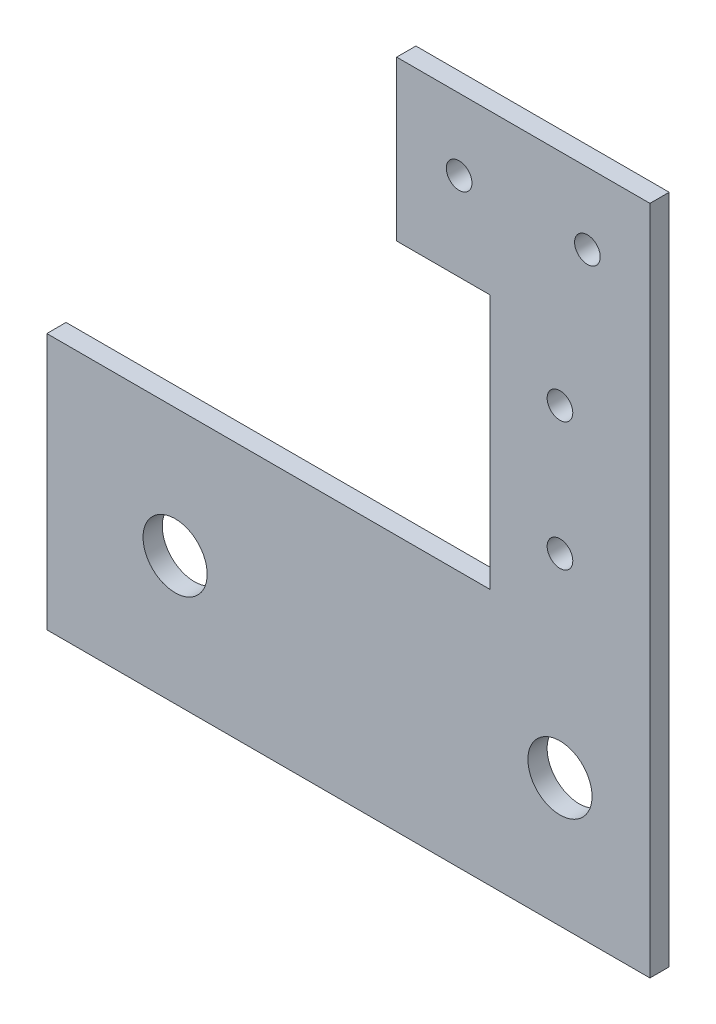
from build123d import *

# Parameters (mm, degrees)
SKETCH1_R           = 2.5
SKETCH1_R_2         = 1
BOSS_EXTRUDE1_DEPTH = 1.5


with BuildPart() as part:
    # Sketch1 → Boss-Extrude1 (new body)
    with BuildSketch(Plane.XY):
        Polygon((-19.743694785, 19.646203879), (-12.475339463, 19.646203879), (-12.475339463, -0.233517887), (-47.013694785, -0.233517887), (-47.013694785, -20.233517887), (0, -20.233517887), (0, 0), (0, 32.06155097), (-19.743694785, 32.06155097), align=None)
        with Locations((-37.013694785, -10.233517887)):
            Circle(SKETCH1_R, mode=Mode.SUBTRACT)
        with BuildLine():
            ThreePointArc((-4.513694785, -10.233517887), (-7.013694785, -12.733517887), (-9.513694785, -10.233517887))
            ThreePointArc((-9.513694785, -10.233517887), (-7.013694785, -7.733517887), (-4.513694785, -10.233517887))
        make_face(mode=Mode.SUBTRACT)
        with Locations((-7.013694785, 4.91155097)):
            Circle(SKETCH1_R_2, mode=Mode.SUBTRACT)
        with Locations((-7.013694785, 14.91155097)):
            Circle(SKETCH1_R_2, mode=Mode.SUBTRACT)
        with Locations((-14.873694785, 26.50155097)):
            Circle(SKETCH1_R_2, mode=Mode.SUBTRACT)
        with Locations((-4.873694785, 26.50155097)):
            Circle(SKETCH1_R_2, mode=Mode.SUBTRACT)
    extrude(amount=BOSS_EXTRUDE1_DEPTH)


solid = part.part
